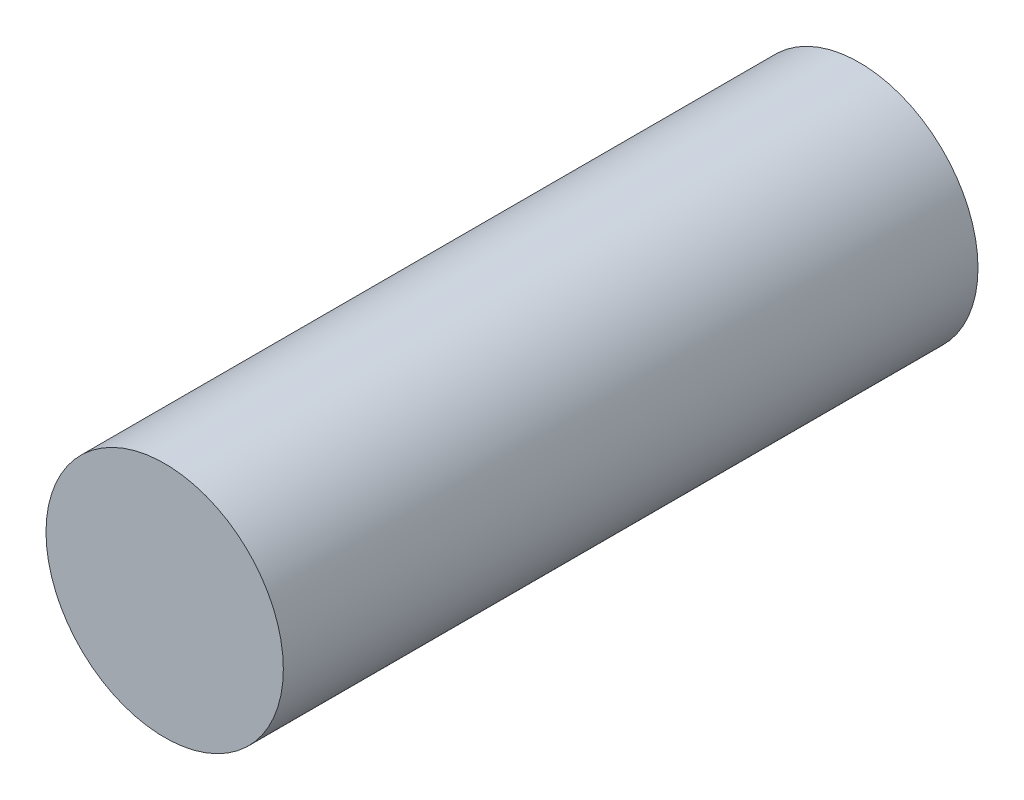
from build123d import *

# Parameters (mm, degrees)
SKETCH_1_W          = 66
SKETCH_1_H          = 56
EXTRUDE_1_DEPTH     = 24
SKETCH_2_OUTSIDE_W  = 85.964
SKETCH_2_OUTSIDE_H  = 75.964
SKETCH_2_OUTSIDE_R  = 4.1
CUT_EXTRUDE_1_DEPTH = 50.487372127


with BuildPart() as part:
    # 草图1 → 凸台-拉伸1 (new body)
    with BuildSketch(Plane.XY):
        Rectangle(SKETCH_1_W, SKETCH_1_H)
    extrude(amount=EXTRUDE_1_DEPTH)

    # 草图2 outside → 切除-拉伸1 (cut, through all)
    with BuildSketch(Plane.XY.offset(24)):
        Rectangle(SKETCH_2_OUTSIDE_W, SKETCH_2_OUTSIDE_H)
        with Locations((0, -1)):
            Circle(SKETCH_2_OUTSIDE_R, mode=Mode.SUBTRACT)
    extrude(amount=-CUT_EXTRUDE_1_DEPTH, mode=Mode.SUBTRACT)


solid = part.part
